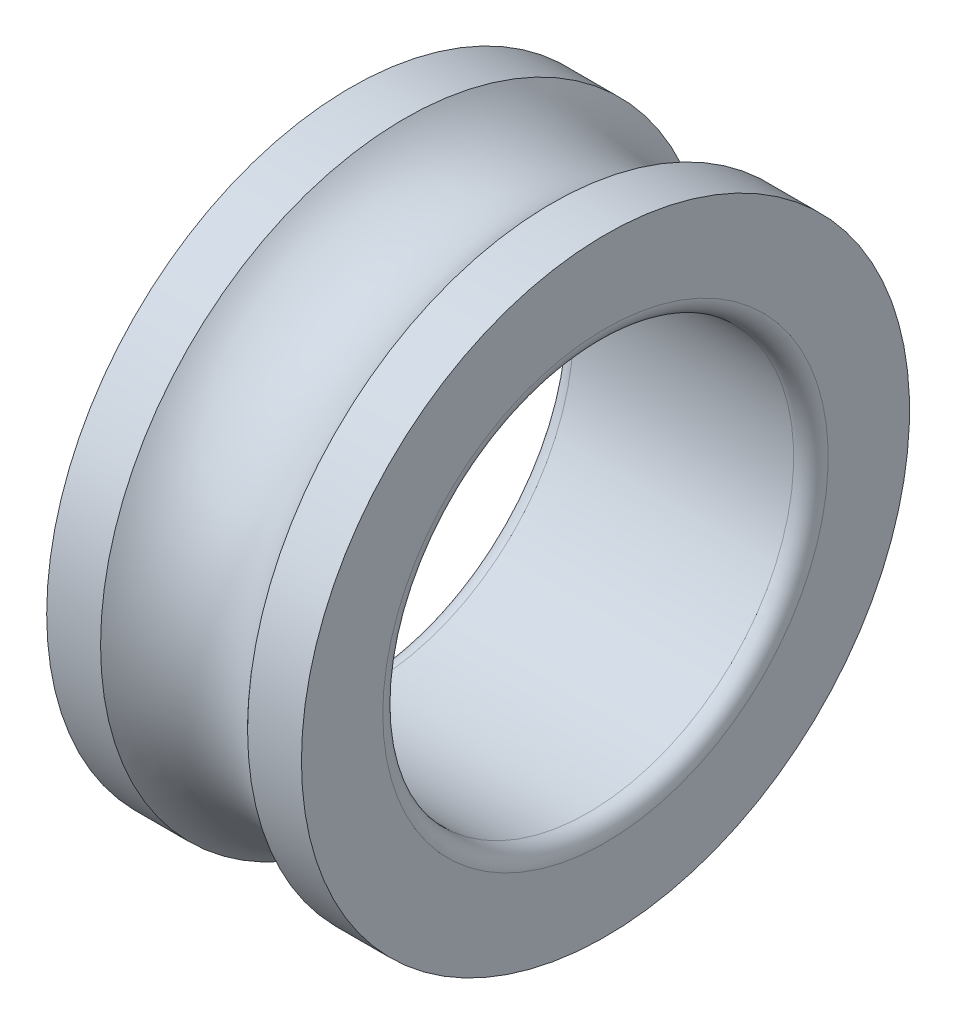
from build123d import *


with BuildPart() as part:
    # Sketch1 → Revolve1 (revolve)
    with BuildSketch(Plane.XY, mode=Mode.PRIVATE) as revolve1_sk:
        with BuildLine():
            Line((134, 250), (-134, 250))
            ThreePointArc((-134, 250), (-148.849242405, 256.150757595), (-155, 271))
            Line((-155, 271), (-155, 370))
            Line((-155, 370), (-89.4427191, 370))
            ThreePointArc((-89.4427191, 370), (0, 330), (89.4427191, 370))
            Line((89.4427191, 370), (155, 370))
            Line((155, 370), (155, 271))
            ThreePointArc((155, 271), (148.849242405, 256.150757595), (134, 250))
        make_face()
    revolve(revolve1_sk.sketch.rotate(Axis((-135.128205128, 0, 0), (1, 0, 0)), 90), axis=Axis((-135.128205128, 0, 0), (1, 0, 0)))


solid = part.part
